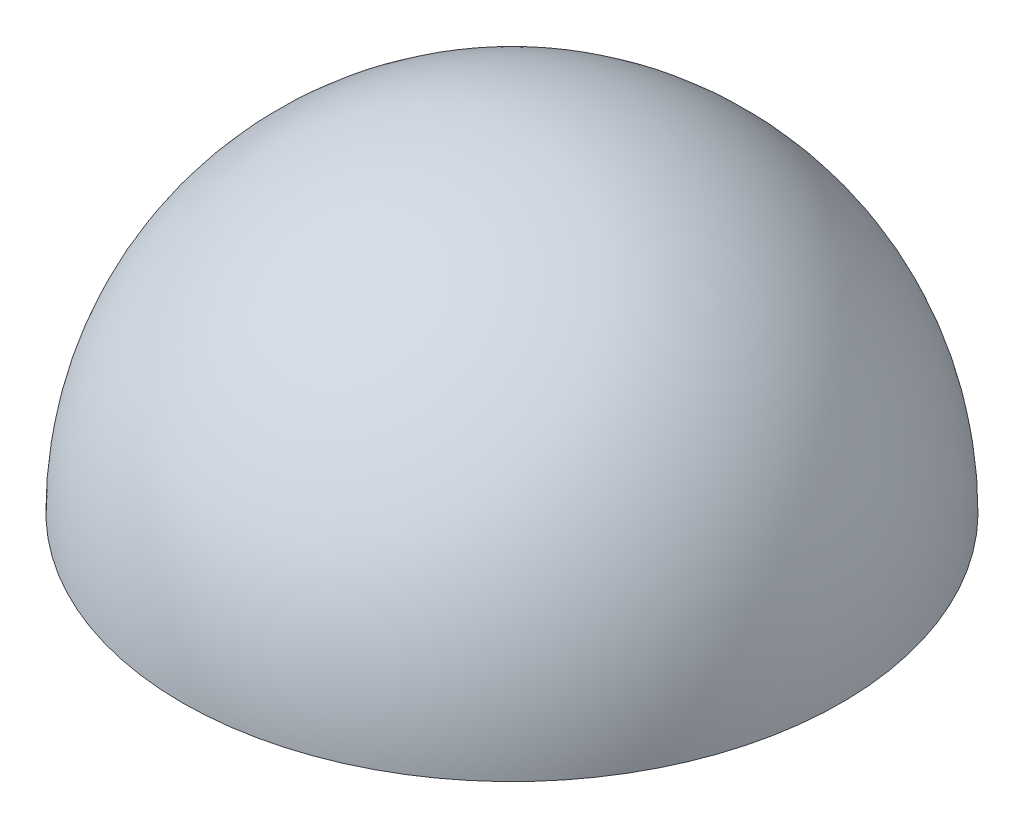
from build123d import *

# Parameters (mm, degrees)
REVOLVE1_ANGLE = 180


with BuildPart() as part:
    # Sketch1 → Revolve1 (revolve)
    with BuildSketch(Plane(origin=(0, 0, 0), x_dir=(1, 0, 0), z_dir=(0, 1, 0))):
        with BuildLine():
            Line((0, 0.8), (0, 0.752871159))
            ThreePointArc((0, 0.752871159), (0.752871159, 0), (0, -0.752871159))
            Line((0, -0.752871159), (0, -0.8))
            ThreePointArc((0, -0.8), (0.8, 0), (0, 0.8))
        make_face()
    revolve(axis=Axis((0, 0, 0.752871159), (0, 0, 1)), revolution_arc=REVOLVE1_ANGLE)


solid = part.part
